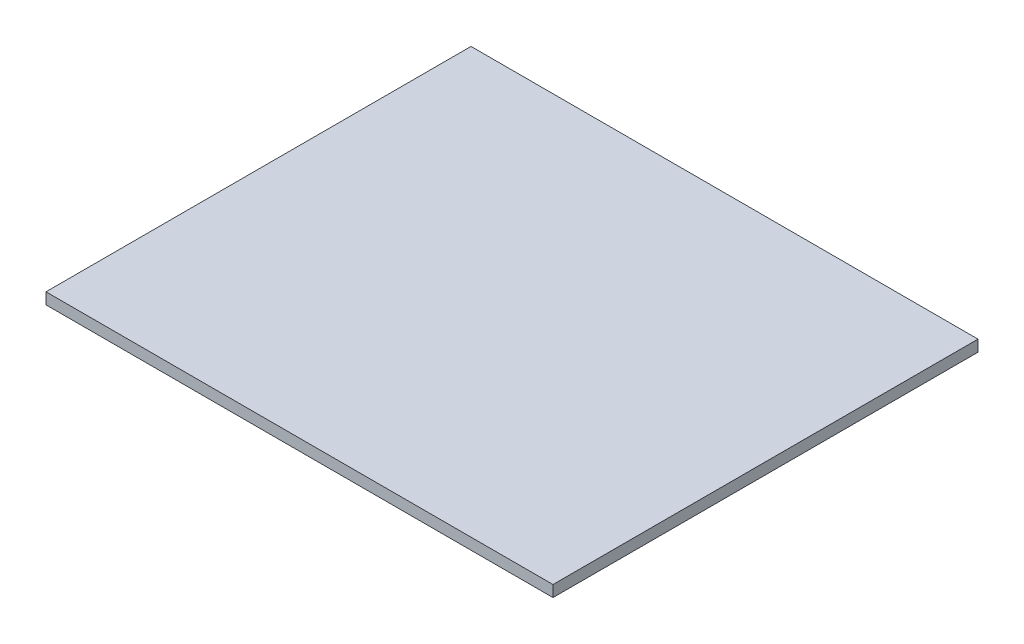
from build123d import *

# Parameters (mm, degrees)
SKETCH_1_W      = 357.863501484
SKETCH_1_H      = 300
EXTRUDE_1_DEPTH = 8


with BuildPart() as part:
    # 草图1 → 凸台-拉伸1 (new body)
    with BuildSketch(Plane(origin=(0, 0, 0), x_dir=(1, 0, 0), z_dir=(0, 1, 0))):
        Rectangle(SKETCH_1_W, SKETCH_1_H)
    extrude(amount=EXTRUDE_1_DEPTH)


solid = part.part
